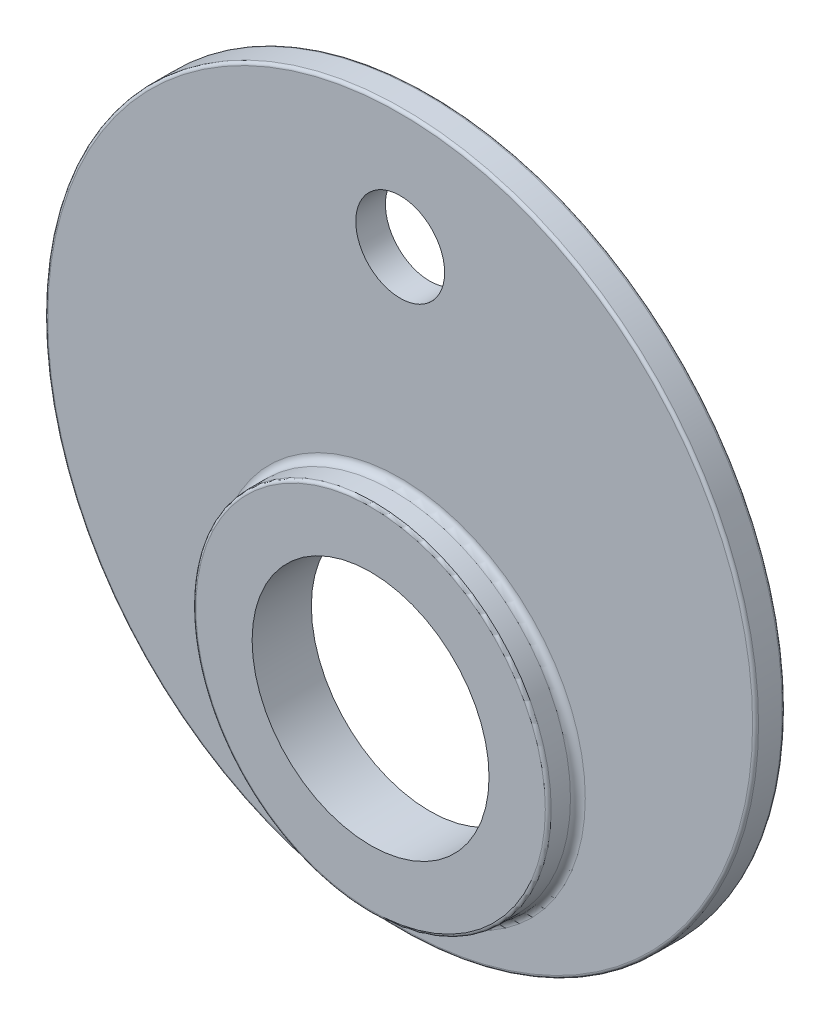
from build123d import *

# Parameters (mm, degrees)
SKETCH1_R           = 304.8
SKETCH1_R_2         = 101.6
SKETCH1_R_3         = 38.1
BOSS_EXTRUDE1_DEPTH = 25.4
SKETCH2_R           = 152.4
SKETCH2_R_2         = 101.6
BOSS_EXTRUDE2_DEPTH = 25.4
FILLET1_R           = 2.54
FILLET2_R           = 6.35


with BuildPart() as part:
    # Sketch1 → Boss-Extrude1 (new body)
    with BuildSketch(Plane.XY):
        Circle(SKETCH1_R)
        with Locations((0, -127)):
            Circle(SKETCH1_R_2, mode=Mode.SUBTRACT)
        with Locations((0, 203.2)):
            Circle(SKETCH1_R_3, mode=Mode.SUBTRACT)
    extrude(amount=BOSS_EXTRUDE1_DEPTH)

    # Sketch2 → Boss-Extrude2 (add)
    with BuildSketch(Plane.XY.offset(25.4)):
        with Locations((0, -127)):
            Circle(SKETCH2_R)
        with Locations((0, -127)):
            Circle(SKETCH2_R_2, mode=Mode.SUBTRACT)
    extrude(amount=BOSS_EXTRUDE2_DEPTH)

    # Fillet1
    fillet1_edges = [part.edges().sort_by_distance(p)[0] for p in [
        (-152.4, -127, 50.8),
        (-304.8, 0, 0),
        (-304.8, 0, 25.4),
    ]]
    fillet(fillet1_edges, radius=FILLET1_R)

    # Fillet2
    fillet2_edges = [part.edges().sort_by_distance(p)[0] for p in [
        (-152.4, -127, 25.4),
    ]]
    fillet(fillet2_edges, radius=FILLET2_R)


solid = part.part
